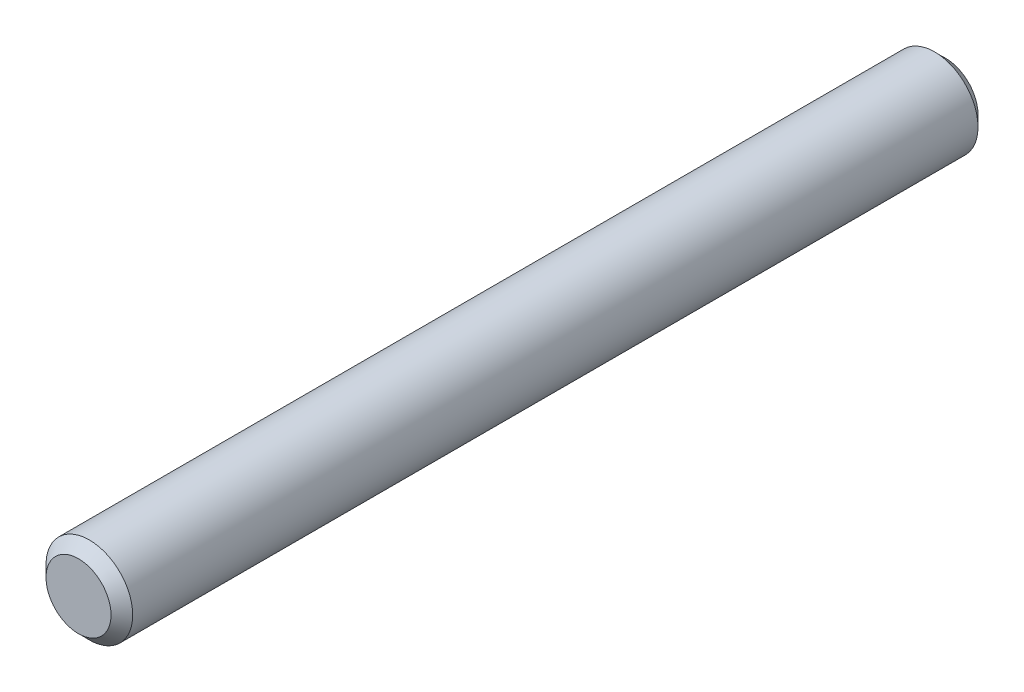
from build123d import *

# Parameters (mm, degrees)
SZKIC1_R                    = 4
DODANIE_WYCI_GNI_CIE1_DEPTH = 40
SFAZOWANIE1_SIZE            = 1


with BuildPart() as part:
    # Szkic1 → Dodanie-wyciągnięcie1 (new, symmetric)
    with BuildSketch(Plane.XY):
        Circle(SZKIC1_R)
    extrude(amount=DODANIE_WYCI_GNI_CIE1_DEPTH, both=True)

    # Sfazowanie1
    sfazowanie1_edges = [part.edges().sort_by_distance(p)[0] for p in [
        (-4, 0, -40),
        (-4, 0, 40),
    ]]
    chamfer(sfazowanie1_edges, length=SFAZOWANIE1_SIZE)


solid = part.part
